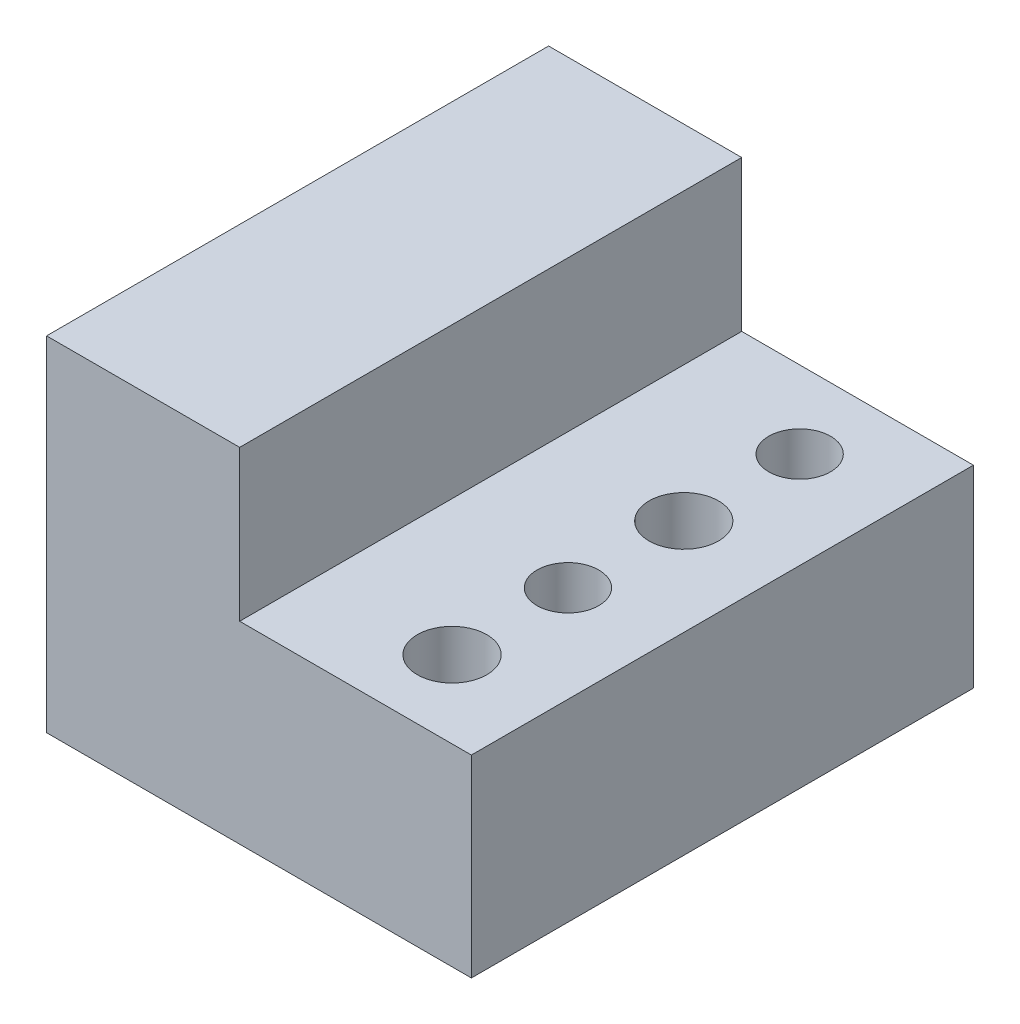
from build123d import *

# Parameters (mm, degrees)
EXTRUDE_1_DEPTH     = 65
MM_1_D              = 8
SKETCH_5_R          = 4.5
CUT_EXTRUDE_1_DEPTH = 89.741196746
SKETCH_6_R          = 7.5
CUT_EXTRUDE_2_DEPTH = 10
SKETCH_7_R          = 3.4
SKETCH_7_R_2        = 4
CUT_EXTRUDE_3_DEPTH = 24


with BuildPart() as part:
    # 草图1 → 凸台-拉伸1 (new body)
    with BuildSketch(Plane.XY):
        Polygon((-30, 44.5), (-30, 25), (0, 25), (0, 0), (-55, 0), (-55, 44.5), align=None)
    extrude(amount=EXTRUDE_1_DEPTH)

    # 大小mm 暗销孔1 (through all)
    with Locations(Plane(origin=(0, 25, 0), x_dir=(1, 0, 0), z_dir=(0, 1, 0))):
        with Locations((-12.5, -10), (-12.5, -40)):
            Hole(MM_1_D / 2)

    # 草图5 → 切除-拉伸1 (cut, through all)
    with BuildSketch(Plane(origin=(0, 25, 0), x_dir=(1, 0, 0), z_dir=(0, 1, 0))):
        with Locations(Location((-12.5, -25, 0), (0, 0, 270))):
            Circle(SKETCH_5_R)
        with Locations(Location((-12.5, -55, 0), (0, 0, 270))):
            Circle(SKETCH_5_R)
    extrude(amount=-CUT_EXTRUDE_1_DEPTH, mode=Mode.SUBTRACT)

    # 草图6 → 切除-拉伸2 (cut)
    with BuildSketch(Plane.XZ):
        with Locations((-12.5, 55)):
            Circle(SKETCH_6_R)
        with Locations((-12.5, 25)):
            Circle(SKETCH_6_R)
    extrude(amount=-CUT_EXTRUDE_2_DEPTH, mode=Mode.SUBTRACT)

    # 草图7 → 切除-拉伸3 (cut)
    with BuildSketch(Plane.ZY.offset(55)):
        with Locations((10, 32)):
            Circle(SKETCH_7_R)
        with Locations((25, 32)):
            Circle(SKETCH_7_R_2)
        with Locations((40, 32)):
            Circle(SKETCH_7_R)
        with Locations((55, 32)):
            Circle(SKETCH_7_R_2)
    extrude(amount=-CUT_EXTRUDE_3_DEPTH, mode=Mode.SUBTRACT)


solid = part.part
